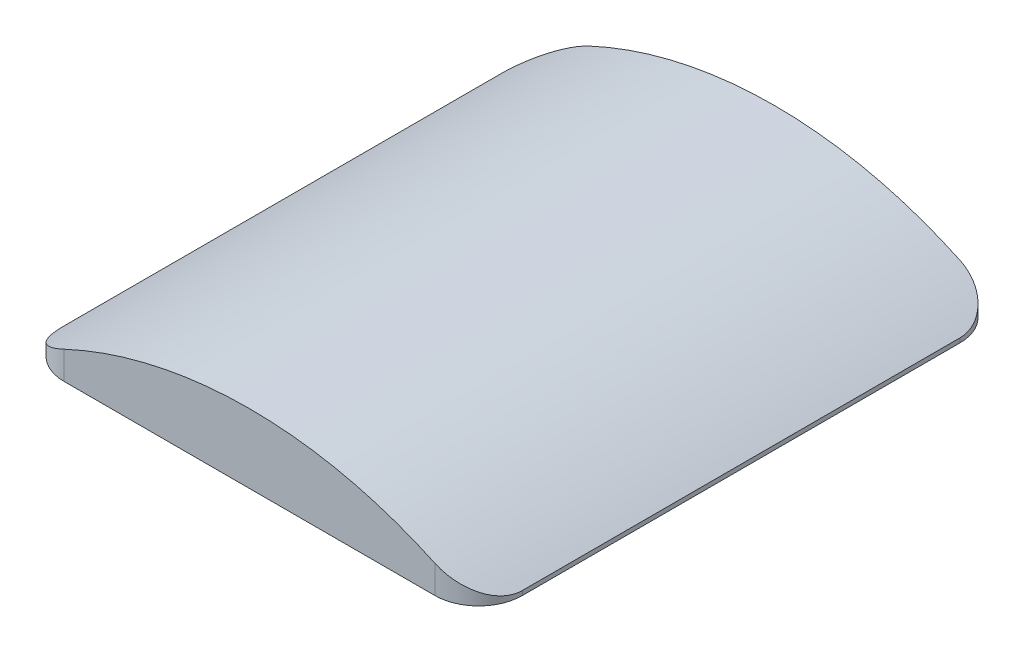
from build123d import *

# Parameters (mm, degrees)
BOSS_EXTRUDE1_DEPTH = 60
FILLET1_R           = 10


with BuildPart() as part:
    # Sketch1 → Boss-Extrude1 (new, symmetric)
    with BuildSketch(Plane.XY):
        with BuildLine():
            Line((52.375, -25.867869753), (52.375, -26.867869753))
            Line((52.375, -26.867869753), (-52.375, -26.867869753))
            Line((-52.375, -26.867869753), (-52.375, -25.867869753))
            ThreePointArc((-52.375, -25.867869753), (0, -11.055071697), (52.375, -25.867869753))
        make_face()
    extrude(amount=BOSS_EXTRUDE1_DEPTH, both=True)

    # Fillet1
    fillet1_edges = [part.edges().sort_by_distance(p)[0] for p in [
        (52.375, -26.367869753, 60),
        (52.375, -26.367869753, -60),
        (-52.375, -26.367869753, -60),
        (-52.375, -26.367869753, 60),
    ]]
    fillet(fillet1_edges, radius=FILLET1_R)


solid = part.part
